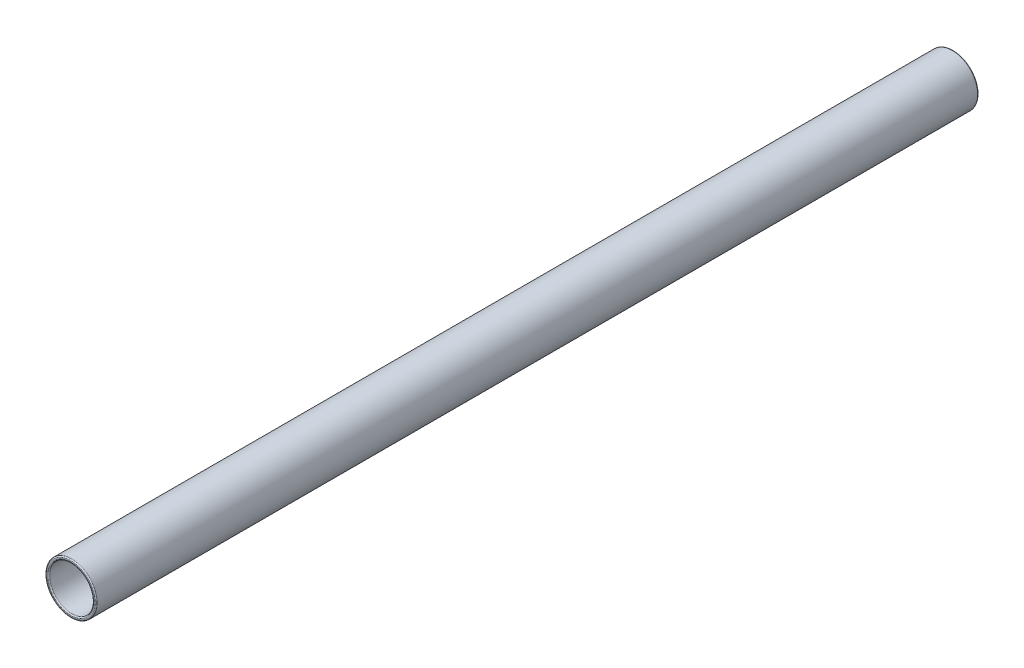
from build123d import *

# Parameters (mm, degrees)
SKETCH1_R           = 11.5
SKETCH1_R_2         = 10
EXTRUDE_THIN1_DEPTH = 200
FILLET1_R           = 0.5


with BuildPart() as part:
    # Sketch1 → Extrude-Thin1 (new, symmetric)
    with BuildSketch(Plane.XY):
        Circle(SKETCH1_R)
        Circle(SKETCH1_R_2, mode=Mode.SUBTRACT)
    extrude(amount=EXTRUDE_THIN1_DEPTH, both=True)

    # Fillet1
    fillet1_edges = [part.edges().sort_by_distance(p)[0] for p in [
        (-11.5, 0, -200),
        (-10, 0, -200),
        (-11.5, 0, 200),
        (-10, 0, 200),
    ]]
    fillet(fillet1_edges, radius=FILLET1_R)


solid = part.part
